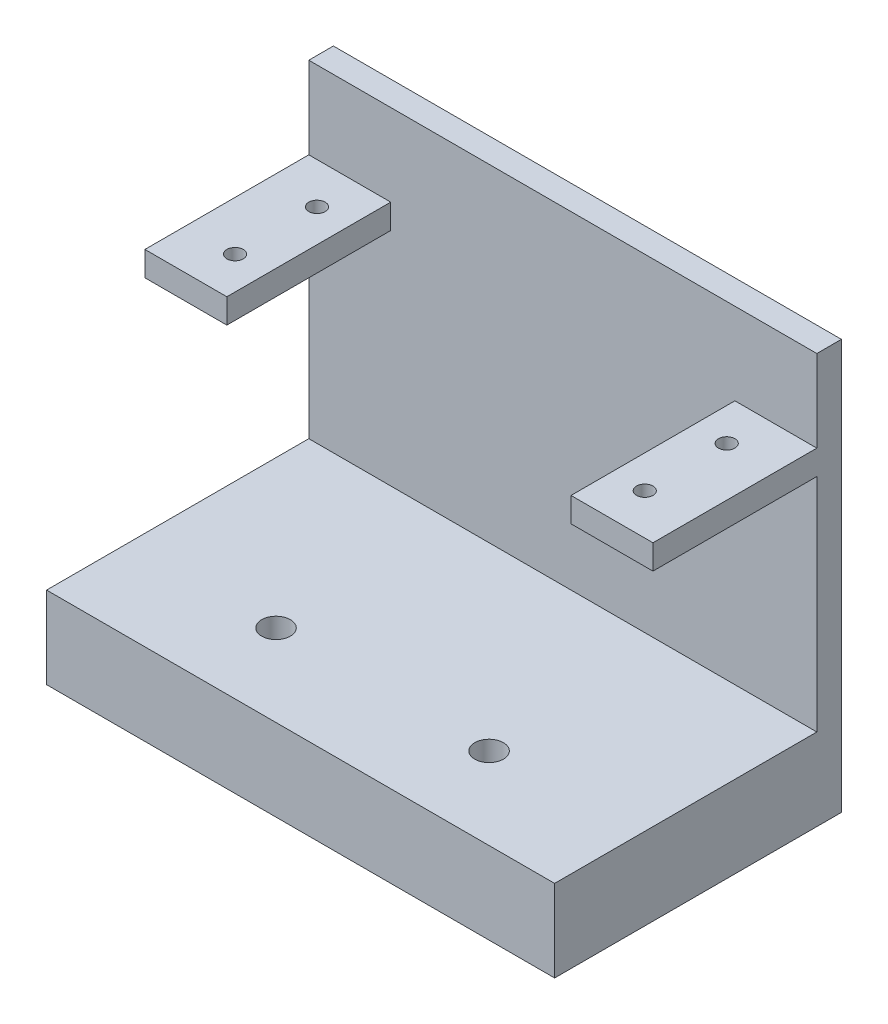
from build123d import *

# Parameters (mm, degrees)
SKETCH1_W           = 62
SKETCH1_H           = 35
BOSS_EXTRUDE1_DEPTH = 50
CUT_EXTRUDE3_DEPTH  = 88
SKETCH4_W           = 42
SKETCH4_H           = 20
CUT_EXTRUDE5_DEPTH  = 40
SKETCH5_R           = 1.75
CUT_EXTRUDE7_DEPTH  = 100
CUT_EXTRUDE8_REACH  = 83.664
SKETCH6_R           = 1


with BuildPart() as part:
    # Sketch1 → Boss-Extrude1 (new body)
    with BuildSketch(Plane(origin=(0, 0, 0), x_dir=(1, 0, 0), z_dir=(0, 1, 0))):
        with Locations((31, 17.5)):
            Rectangle(SKETCH1_W, SKETCH1_H)
    extrude(amount=BOSS_EXTRUDE1_DEPTH)

    # Sketch2 → Cut-Extrude3 (cut, through all)
    with BuildSketch(Plane(origin=(62, 0, 0), x_dir=(0, 0, -1), z_dir=(1, 0, 0))):
        Polygon((0, 10), (32, 10), (32, 37), (12, 37), (12, 40), (32, 40), (32, 50), (0, 50), align=None)
    extrude(amount=-CUT_EXTRUDE3_DEPTH, mode=Mode.SUBTRACT)

    # Sketch4 → Cut-Extrude5 (cut)
    with BuildSketch(Plane(origin=(0, 10, 0), x_dir=(1, 0, 0), z_dir=(0, 1, 0))):
        with Locations((31, 22)):
            Rectangle(SKETCH4_W, SKETCH4_H)
    extrude(amount=CUT_EXTRUDE5_DEPTH, mode=Mode.SUBTRACT)

    # Sketch5 → Cut-Extrude7 (cut)
    with BuildSketch(Plane(origin=(0, 10, 0), x_dir=(1, 0, 0), z_dir=(0, 1, 0))):
        with Locations((18, 10)):
            Circle(SKETCH5_R)
        with Locations((44, 10)):
            Circle(SKETCH5_R)
    extrude(amount=-CUT_EXTRUDE7_DEPTH, mode=Mode.SUBTRACT)

    # Sketch6 → Cut-Extrude8 (cut, up to next)
    with BuildSketch(Plane(origin=(0, 40, 0), x_dir=(1, 0, 0), z_dir=(0, 1, 0)), mode=Mode.PRIVATE) as cut_extrude8_sk1:
        with Locations((6, 27)):
            Circle(SKETCH6_R)
    cut_extrude8_tool1 = extrude(cut_extrude8_sk1.sketch, amount=-CUT_EXTRUDE8_REACH, mode=Mode.PRIVATE) & part.part
    # Sketch6 → Cut-Extrude8 (cut, up to next)
    with BuildSketch(Plane(origin=(0, 40, 0), x_dir=(1, 0, 0), z_dir=(0, 1, 0)), mode=Mode.PRIVATE) as cut_extrude8_sk2:
        with Locations((6, 17)):
            Circle(SKETCH6_R)
    cut_extrude8_tool2 = extrude(cut_extrude8_sk2.sketch, amount=-CUT_EXTRUDE8_REACH, mode=Mode.PRIVATE) & part.part
    # Sketch6 → Cut-Extrude8 (cut, up to next)
    with BuildSketch(Plane(origin=(0, 40, 0), x_dir=(1, 0, 0), z_dir=(0, 1, 0)), mode=Mode.PRIVATE) as cut_extrude8_sk3:
        with Locations((56, 17)):
            Circle(SKETCH6_R)
    cut_extrude8_tool3 = extrude(cut_extrude8_sk3.sketch, amount=-CUT_EXTRUDE8_REACH, mode=Mode.PRIVATE) & part.part
    # Sketch6 → Cut-Extrude8 (cut, up to next)
    with BuildSketch(Plane(origin=(0, 40, 0), x_dir=(1, 0, 0), z_dir=(0, 1, 0)), mode=Mode.PRIVATE) as cut_extrude8_sk4:
        with Locations((56, 27)):
            Circle(SKETCH6_R)
    cut_extrude8_tool4 = extrude(cut_extrude8_sk4.sketch, amount=-CUT_EXTRUDE8_REACH, mode=Mode.PRIVATE) & part.part
    add(cut_extrude8_tool1.solids().sort_by_distance((6, 40, -27))[0], mode=Mode.SUBTRACT)
    add(cut_extrude8_tool2.solids().sort_by_distance((6, 40, -17))[0], mode=Mode.SUBTRACT)
    add(cut_extrude8_tool3.solids().sort_by_distance((56, 40, -17))[0], mode=Mode.SUBTRACT)
    add(cut_extrude8_tool4.solids().sort_by_distance((56, 40, -27))[0], mode=Mode.SUBTRACT)


solid = part.part
